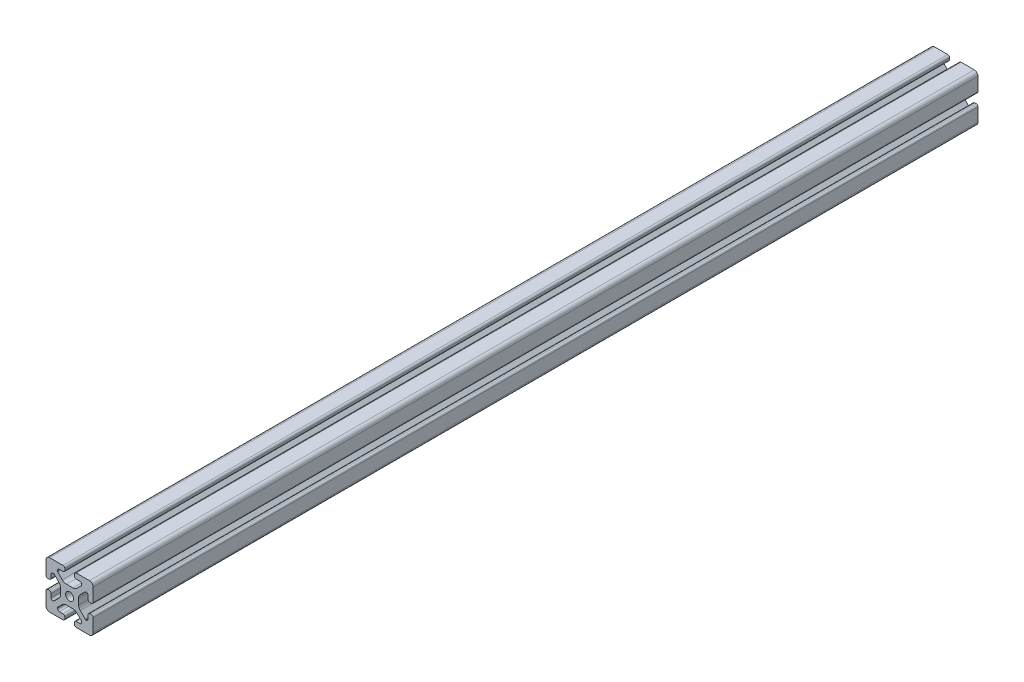
from build123d import *

# Parameters (mm, degrees)
SKETCH1_R      = 3.4
EXTRUDE1_DEPTH = 750


with BuildPart() as part:
    # Sketch1 → Extrude1 (new body)
    with BuildSketch(Plane.XY):
        with BuildLine():
            Line((-8.715, -15.524615034), (-5.63, -15.524615034))
            ThreePointArc((-5.63, -15.524615034), (-4.519842354, -15.984457388), (-4.06, -17.094615034))
            Line((-4.06, -17.094615034), (-4.06, -18.43))
            ThreePointArc((-4.06, -18.43), (-4.519842354, -19.540157646), (-5.63, -20))
            Line((-5.63, -20), (-16.674615034, -20))
            ThreePointArc((-16.674615034, -20), (-18.951578385, -19.194274381), (-20, -17.018368134))
            Line((-20, -17.018368134), (-20, -5.757918808))
            ThreePointArc((-20, -5.757918808), (-19.564709668, -4.603883664), (-18.43, -4.120449326))
            Line((-18.43, -4.120449326), (-17.25, -4.120449326))
            ThreePointArc((-17.25, -4.120449326), (-16.115287682, -4.60388249), (-15.67999625, -5.757919334))
            Line((-15.67999625, -5.757919334), (-15.67999625, -8.715399492))
            ThreePointArc((-15.67999625, -8.715399492), (-15.220153896, -9.825557139), (-14.10999625, -10.285399492))
            Line((-14.10999625, -10.285399492), (-13.816898819, -10.285399492))
            ThreePointArc((-13.816898819, -10.285399492), (-13.526061711, -10.227547119), (-13.279501941, -10.062800646))
            Line((-13.279501941, -10.062800646), (-9.076242789, -5.859541495))
            ThreePointArc((-9.076242789, -5.859541495), (-8.046572221, -4.318530588), (-7.685, -2.500784284))
            Line((-7.685, -2.500784284), (-7.685, 2.500784284))
            ThreePointArc((-7.685, 2.500784284), (-8.046572221, 4.318530588), (-9.076242789, 5.859541495))
            Line((-9.076242789, 5.859541495), (-13.040489136, 9.823787841))
            ThreePointArc((-13.040489136, 9.823787841), (-13.354224618, 10.012729352), (-13.71989919, 10.033001362))
            Line((-13.71989919, 10.033001362), (-14.05520779, 10.044710596))
            ThreePointArc((-14.05520779, 10.044710596), (-15.200613642, 9.605030484), (-15.68, 8.475666998))
            Line((-15.68, 8.475666998), (-15.68, 5.572979049))
            ThreePointArc((-15.68, 5.572979049), (-16.139842354, 4.462821403), (-17.25, 4.002979049))
            Line((-17.25, 4.002979049), (-18.43, 4.002979049))
            ThreePointArc((-18.43, 4.002979049), (-19.540157646, 4.462821403), (-20, 5.572979049))
            Line((-20, 5.572979049), (-20, 13.004526564))
            Line((-20, 13.004526564), (-20, 16.83))
            ThreePointArc((-20, 16.83), (-19.071528496, 19.071528496), (-16.83, 20))
            Line((-16.83, 20), (-5.63, 20))
            ThreePointArc((-5.63, 20), (-4.519842354, 19.540157646), (-4.06, 18.43))
            Line((-4.06, 18.43), (-4.06, 17.094615034))
            ThreePointArc((-4.06, 17.094615034), (-4.519842354, 15.984457388), (-5.63, 15.524615034))
            Line((-5.63, 15.524615034), (-8.715, 15.524615034))
            ThreePointArc((-8.715, 15.524615034), (-9.825157646, 15.06477268), (-10.285, 13.954615034))
            Line((-10.285, 13.954615034), (-10.285, 13.492503602))
            ThreePointArc((-10.285, 13.492503602), (-10.227148445, 13.201664194), (-10.062401154, 12.955102448))
            Line((-10.062401154, 12.955102448), (-6.217092793, 9.109794088))
            ThreePointArc((-6.217092793, 9.109794088), (-4.63891877, 8.055291919), (-2.777335583, 7.685))
            Line((-2.777335583, 7.685), (2.777335583, 7.685))
            ThreePointArc((2.777335583, 7.685), (4.63891877, 8.055291919), (6.217092793, 9.109794088))
            Line((6.217092793, 9.109794088), (10.062401154, 12.955102448))
            ThreePointArc((10.062401154, 12.955102448), (10.227148445, 13.201664194), (10.285, 13.492503602))
            Line((10.285, 13.492503602), (10.285, 13.954615034))
            ThreePointArc((10.285, 13.954615034), (9.825157646, 15.06477268), (8.715, 15.524615034))
            Line((8.715, 15.524615034), (5.63, 15.524615034))
            ThreePointArc((5.63, 15.524615034), (4.519842354, 15.984457388), (4.06, 17.094615034))
            Line((4.06, 17.094615034), (4.06, 18.43))
            ThreePointArc((4.06, 18.43), (4.519842354, 19.540157646), (5.63, 20))
            Line((5.63, 20), (12.979635074, 20))
            Line((12.979635074, 20), (16.83, 20))
            ThreePointArc((16.83, 20), (19.071528496, 19.071528496), (20, 16.83))
            Line((20, 16.83), (20, 13.001098436))
            Line((20, 13.001098436), (20, 5.63))
            ThreePointArc((20, 5.63), (19.540157461, 4.519842693), (18.43, 4.060000526))
            Line((18.43, 4.060000526), (17.24999625, 4.060000526))
            ThreePointArc((17.24999625, 4.060000526), (16.139838603, 4.519842879), (15.67999625, 5.630000526))
            Line((15.67999625, 5.630000526), (15.67999625, 8.715399492))
            ThreePointArc((15.67999625, 8.715399492), (15.220153896, 9.825557139), (14.10999625, 10.285399492))
            Line((14.10999625, 10.285399492), (13.816903094, 10.285399492))
            ThreePointArc((13.816903094, 10.285399492), (13.526063686, 10.227547937), (13.279501941, 10.062800646))
            Line((13.279501941, 10.062800646), (9.076242789, 5.859541495))
            ThreePointArc((9.076242789, 5.859541495), (8.046572221, 4.318530588), (7.685, 2.500784284))
            Line((7.685, 2.500784284), (7.685, -2.500784284))
            ThreePointArc((7.685, -2.500784284), (8.046572221, -4.318530588), (9.076242789, -5.859541495))
            Line((9.076242789, -5.859541495), (13.163657296, -9.946956002))
            ThreePointArc((13.163657296, -9.946956002), (13.35903797, -10.160433474), (13.6200547, -10.285399492))
            Line((13.6200547, -10.285399492), (14.10999625, -10.285399492))
            ThreePointArc((14.10999625, -10.285399492), (15.220153896, -9.825557139), (15.67999625, -8.715399492))
            Line((15.67999625, -8.715399492), (15.67999625, -5.630000526))
            ThreePointArc((15.67999625, -5.630000526), (16.139838603, -4.519842879), (17.24999625, -4.060000526))
            Line((17.24999625, -4.060000526), (18.43, -4.060000526))
            ThreePointArc((18.43, -4.060000526), (19.540157461, -4.519842693), (20, -5.63))
            Line((20, -5.63), (20, -16.83))
            ThreePointArc((20, -16.83), (19.071528496, -19.071528496), (16.83, -20))
            Line((16.83, -20), (13, -20))
            Line((13, -20), (5.63, -20))
            ThreePointArc((5.63, -20), (4.519842354, -19.540157646), (4.06, -18.43))
            Line((4.06, -18.43), (4.06, -17.094615034))
            ThreePointArc((4.06, -17.094615034), (4.519842354, -15.984457388), (5.63, -15.524615034))
            Line((5.63, -15.524615034), (8.715, -15.524615034))
            ThreePointArc((8.715, -15.524615034), (9.825157646, -15.06477268), (10.285, -13.954615034))
            Line((10.285, -13.954615034), (10.285, -13.492503602))
            ThreePointArc((10.285, -13.492503602), (10.227148445, -13.201664194), (10.062401154, -12.955102448))
            Line((10.062401154, -12.955102448), (6.217092793, -9.109794088))
            ThreePointArc((6.217092793, -9.109794088), (4.63891877, -8.055291919), (2.777335583, -7.685))
            Line((2.777335583, -7.685), (-2.777335583, -7.685))
            ThreePointArc((-2.777335583, -7.685), (-4.63891877, -8.055291919), (-6.217092793, -9.109794088))
            Line((-6.217092793, -9.109794088), (-10.062401154, -12.955102448))
            ThreePointArc((-10.062401154, -12.955102448), (-10.227148445, -13.201664194), (-10.285, -13.492503602))
            Line((-10.285, -13.492503602), (-10.285, -13.954615034))
            ThreePointArc((-10.285, -13.954615034), (-9.825157646, -15.06477268), (-8.715, -15.524615034))
        make_face()
        Circle(SKETCH1_R, mode=Mode.SUBTRACT)
    extrude(amount=-EXTRUDE1_DEPTH)


solid = part.part
